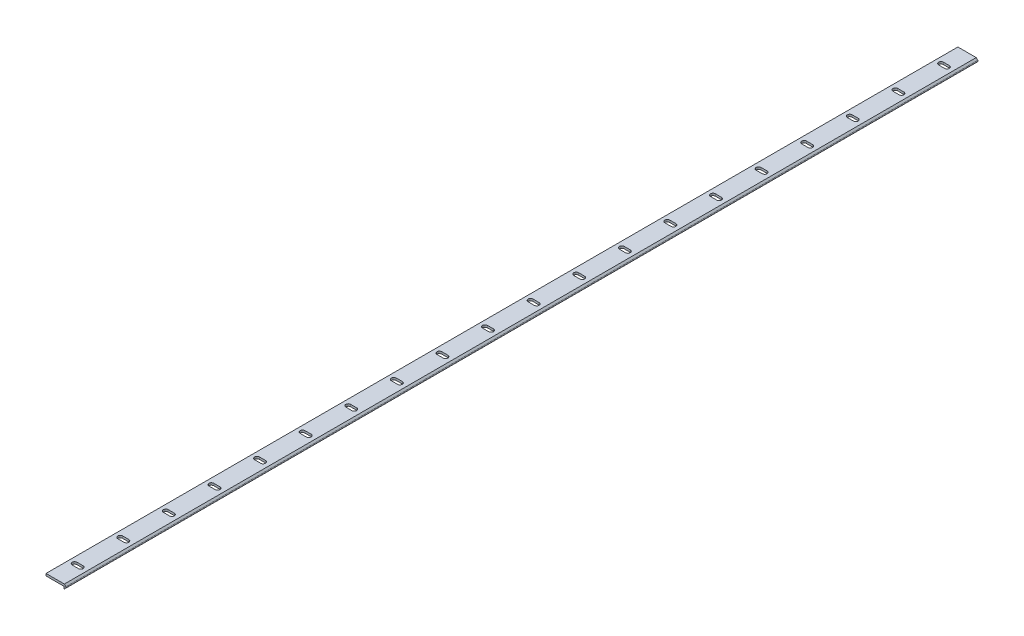
from build123d import *

# Parameters (mm, degrees)
BOSS_EXTRUDE1_DEPTH = 1000
CUT_EXTRUDE1_DEPTH  = 2.375
LPATTERN2_COUNT     = 30
LPATTERN2_PITCH     = 50
FILLET1_R           = 1


with BuildPart() as part:
    # Sketch1 → Boss-Extrude1 (new body)
    with BuildSketch(Plane.XY):
        Polygon((19.5291, 2.375), (0, 2.375), (0, 4.75), (19.5291, 4.75), (20.122, 4.75), (22.497, 2.375), (20.122, 0), (19.5291, 0), align=None)
    extrude(amount=BOSS_EXTRUDE1_DEPTH)

    # Sketch2 → Cut-Extrude1 (cut)
    with BuildSketch(Plane(origin=(0, 4.75, 0), x_dir=(1, 0, 0), z_dir=(0, 1, 0))):
        with BuildLine():
            Line((6.4087, -22.35), (13.1087, -22.35))
            ThreePointArc((13.1087, -22.35), (15.7587, -25), (13.1087, -27.65))
            Line((13.1087, -27.65), (6.4087, -27.65))
            ThreePointArc((6.4087, -27.65), (3.7587, -25), (6.4087, -22.35))
        make_face()
    cut_extrude1 = extrude(amount=-CUT_EXTRUDE1_DEPTH, mode=Mode.SUBTRACT)

    # LPattern2: Cut-Extrude1 ×30
    with Locations(*[(0, 0, i * LPATTERN2_PITCH) for i in range(1, LPATTERN2_COUNT)]):
        add(cut_extrude1, mode=Mode.SUBTRACT)

    # Fillet1
    fillet1_edges = [part.edges().sort_by_distance(p)[0] for p in [
        (22.497, 2.375, 500),
    ]]
    fillet(fillet1_edges, radius=FILLET1_R)


solid = part.part
